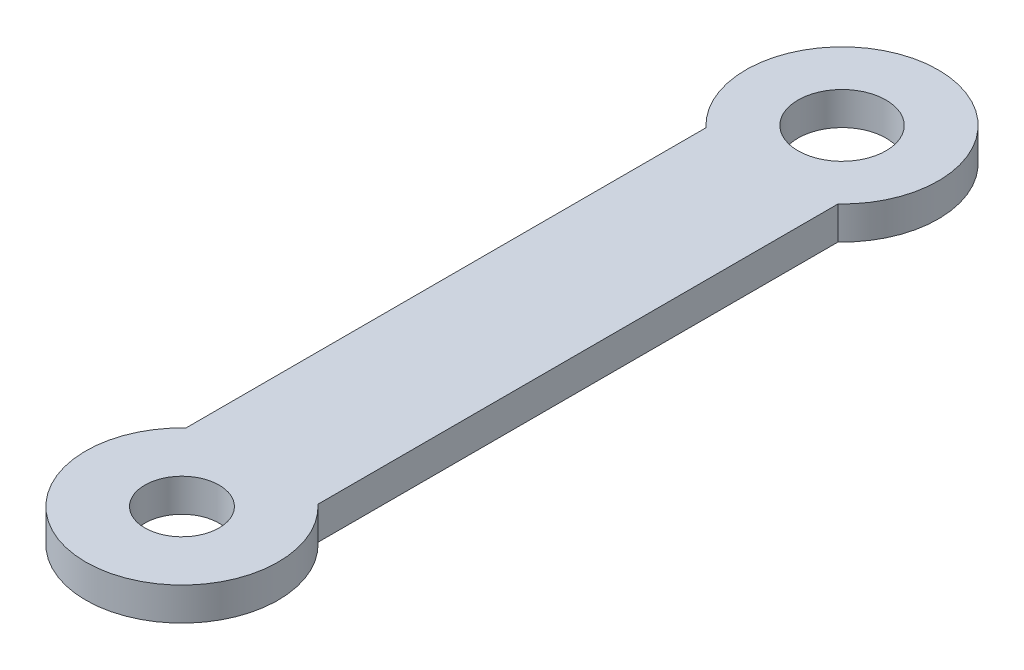
from build123d import *

# Parameters (mm, degrees)
CROQUIS1_R              = 4
CROQUIS1_R_2            = 3.375
SALIENTE_EXTRUIR1_DEPTH = 3


with BuildPart() as part:
    # Croquis1 → Saliente-Extruir1 (new body)
    with BuildSketch(Plane(origin=(0, 0, 0), x_dir=(1, 0, 0), z_dir=(0, 1, 0))):
        with BuildLine():
            Line((-6, 30), (-6, 53.631130399))
            ThreePointArc((-6, 53.631130399), (0, 68.75), (6, 53.631130399))
            Line((6, 53.631130399), (6, 30))
            Line((6, 30), (6, 6.368869601))
            ThreePointArc((6, 6.368869601), (0, -8.75), (-6, 6.368869601))
            Line((-6, 6.368869601), (-6, 30))
        make_face()
        with Locations(Location((0, 60, 0), (0, 0, 270))):
            Circle(CROQUIS1_R, mode=Mode.SUBTRACT)
        with Locations(Location((0, 0, 0), (0, 0, 270))):
            Circle(CROQUIS1_R_2, mode=Mode.SUBTRACT)
    extrude(amount=SALIENTE_EXTRUIR1_DEPTH)


solid = part.part
